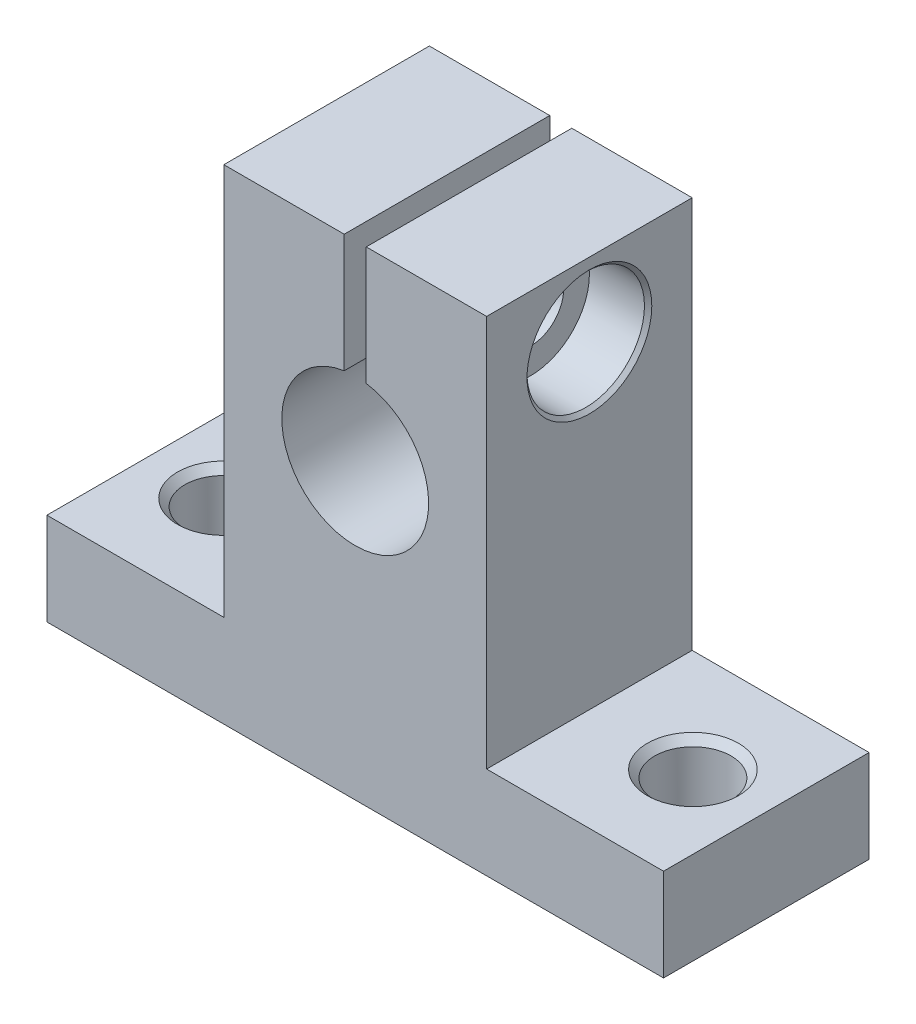
from build123d import *

# Parameters (mm, degrees)
BOSS_EXTRUDE1_DEPTH   = 7
CUT_EXTRUDE1_REACH    = 36.683
SKETCH2_R             = 2.6
CHAMFER1_SIZE         = 0.5
M4X0_7_TAPPED_HOLE1_D = 3.3


with BuildPart() as part:
    # Sketch1 → Boss-Extrude1 (new, symmetric)
    with BuildSketch(Plane.XY):
        with BuildLine():
            Line((-21, 6.3), (-8.95, 6.3))
            Line((-8.95, 6.3), (-8.95, 33))
            Line((-8.95, 33), (-0.75, 33))
            Line((-0.75, 33), (-0.75, 24.943429983))
            ThreePointArc((-0.75, 24.943429983), (0, 15), (0.75, 24.943429983))
            Line((0.75, 24.943429983), (0.75, 33))
            Line((0.75, 33), (8.95, 33))
            Line((8.95, 33), (8.95, 6.3))
            Line((8.95, 6.3), (21, 6.3))
            Line((21, 6.3), (21, 0))
            Line((21, 0), (-21, 0))
            Line((-21, 0), (-21, 6.3))
        make_face()
    extrude(amount=BOSS_EXTRUDE1_DEPTH, both=True)

    # Sketch2 → Cut-Extrude1 (cut, up to next)
    with BuildSketch(Plane(origin=(0, 6.3, 0), x_dir=(1, 0, 0), z_dir=(0, 1, 0)), mode=Mode.PRIVATE) as cut_extrude1_sk1:
        with Locations(Location((16, 0, 0), (0, 0, 270))):
            Circle(SKETCH2_R)
    cut_extrude1_tool1 = extrude(cut_extrude1_sk1.sketch, amount=-CUT_EXTRUDE1_REACH, mode=Mode.PRIVATE) & part.part
    # Sketch2 → Cut-Extrude1 (cut, up to next)
    with BuildSketch(Plane(origin=(0, 6.3, 0), x_dir=(1, 0, 0), z_dir=(0, 1, 0)), mode=Mode.PRIVATE) as cut_extrude1_sk2:
        with Locations(Location((-16, 0, 0), (0, 0, 270))):
            Circle(SKETCH2_R)
    cut_extrude1_tool2 = extrude(cut_extrude1_sk2.sketch, amount=-CUT_EXTRUDE1_REACH, mode=Mode.PRIVATE) & part.part
    add(cut_extrude1_tool1.solids().sort_by_distance((16, 6.3, 0))[0], mode=Mode.SUBTRACT)
    add(cut_extrude1_tool2.solids().sort_by_distance((-16, 6.3, 0))[0], mode=Mode.SUBTRACT)

    # Chamfer1
    chamfer1_edges = [part.edges().sort_by_distance(p)[0] for p in [
        (16, 6.3, -2.6),
        (-16, 6.3, -2.6),
    ]]
    chamfer(chamfer1_edges, length=CHAMFER1_SIZE)

    # Sketch4 → CBORE for M4 SHCS2 (revolve, cut)
    with BuildSketch(Plane(origin=(8.95, 28, 0), x_dir=(0, 0, -1), z_dir=(0, 1, 0))):
        Polygon((0, 0), (0, 8.2), (2.25, 8.2), (2.25, 4), (4, 4), (4, 0.25), (4.25, 0), align=None)
    revolve(axis=Axis((15.3, 28, 0), (-1, 0, 0)), mode=Mode.SUBTRACT)

    # M4x0.7 Tapped Hole1 (through all)
    with Locations(Plane(origin=(-0.75, 0, 0), x_dir=(0, 0, -1), z_dir=(1, 0, 0))):
        with Locations((0, 28)):
            Hole(M4X0_7_TAPPED_HOLE1_D / 2)


solid = part.part
